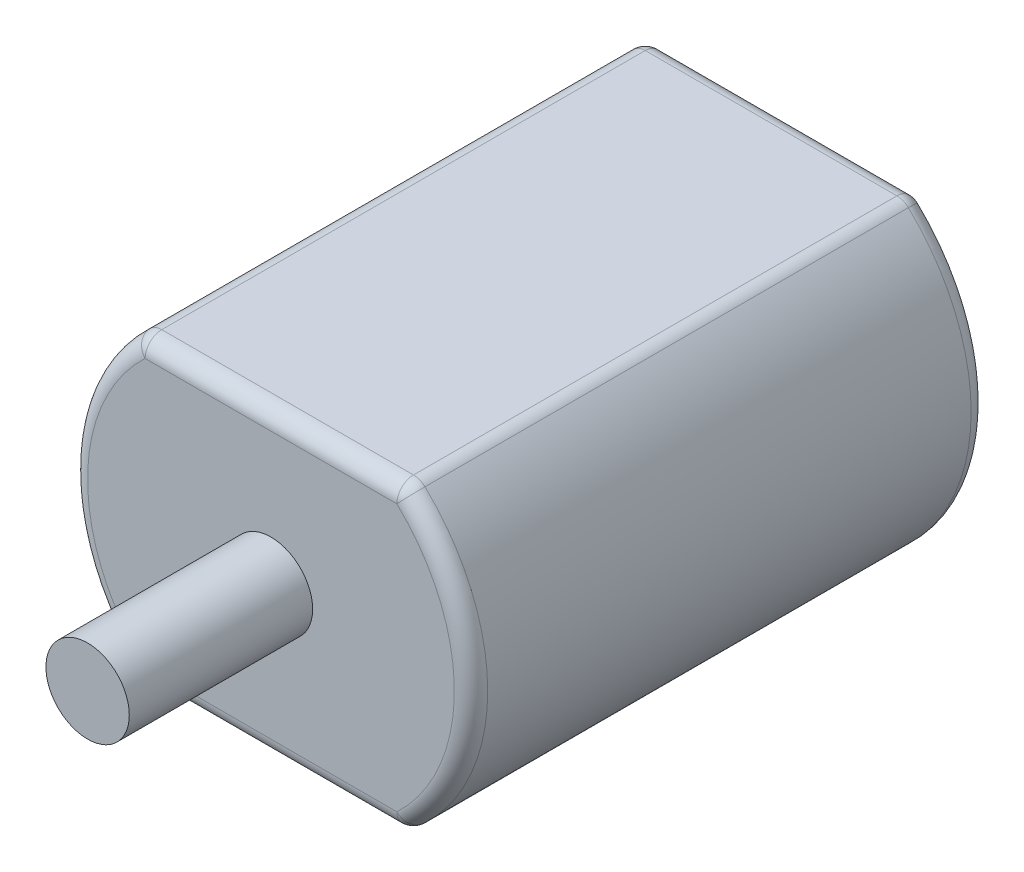
from build123d import *

# Parameters (mm, degrees)
BOSS_EXTRUDE1_DEPTH = 31
SKETCH3_R           = 2.5
BOSS_EXTRUDE2_DEPTH = 11
FILLET1_R           = 1


with BuildPart() as part:
    # Sketch2 → Boss-Extrude1 (new body)
    with BuildSketch(Plane.XY):
        with BuildLine():
            Line((-7.937253933, 9), (7.937253933, 9))
            ThreePointArc((7.937253933, 9), (12, 0), (7.937253933, -9))
            Line((7.937253933, -9), (-7.937253933, -9))
            ThreePointArc((-7.937253933, -9), (-12, 0), (-7.937253933, 9))
        make_face()
    extrude(amount=BOSS_EXTRUDE1_DEPTH)

    # Sketch3 → Boss-Extrude2 (add)
    with BuildSketch(Plane.XY.offset(31)):
        Circle(SKETCH3_R)
    extrude(amount=BOSS_EXTRUDE2_DEPTH)

    # Fillet1
    fillet1_edges = [part.edges().sort_by_distance(p)[0] for p in [
        (0, -9, 31),
        (-12, 0, 31),
        (0, 9, 31),
        (-12, 0, 0),
        (0, -9, 0),
        (12, 0, 0),
        (0, 9, 0),
        (-7.937253933, 9, 15.5),
        (-7.937253933, -9, 15.5),
        (7.937253933, -9, 15.5),
        (7.937253933, 9, 15.5),
        (12, 0, 31),
    ]]
    fillet(fillet1_edges, radius=FILLET1_R)


solid = part.part
